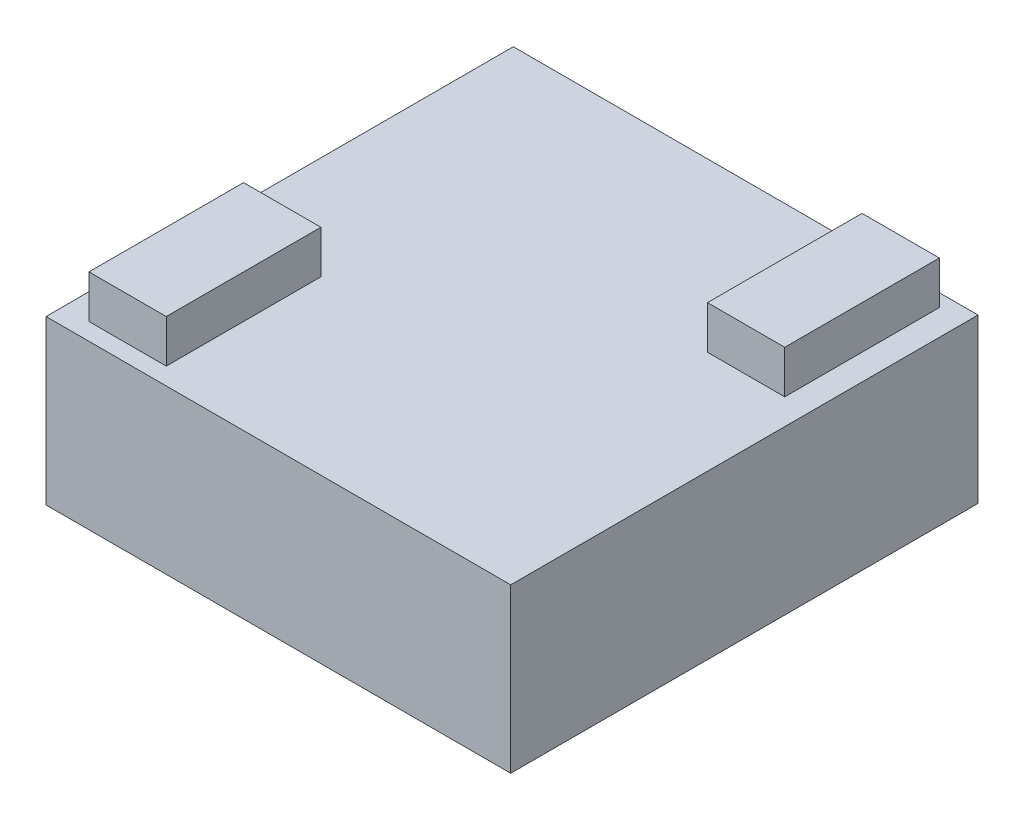
from build123d import *

# Parameters (mm, degrees)
ESQUISSE1_W        = 54.1
ESQUISSE1_H        = 54.4
BOSS_EXTRU_1_DEPTH = 19
ESQUISSE2_W        = 20
ESQUISSE2_H        = 12
BOSS_EXTRU_2_DEPTH = 15
ESQUISSE3_W        = 9
ESQUISSE3_H        = 18
BOSS_EXTRU_3_DEPTH = 5


with BuildPart() as part:
    # Esquisse1 → Boss.-Extru.1 (new body)
    with BuildSketch(Plane(origin=(0, 0, 0), x_dir=(1, 0, 0), z_dir=(0, 1, 0))):
        with Locations((27.05, 27.2)):
            Rectangle(ESQUISSE1_W, ESQUISSE1_H)
    extrude(amount=BOSS_EXTRU_1_DEPTH)

    # Esquisse2 → Boss.-Extru.2 (add)
    with BuildSketch(Plane.XZ):
        with Locations((27, -28.4)):
            Rectangle(ESQUISSE2_W, ESQUISSE2_H)
    extrude(amount=BOSS_EXTRU_2_DEPTH)

    # Esquisse3 → Boss.-Extru.3 (add)
    with BuildSketch(Plane(origin=(0, 19, 0), x_dir=(1, 0, 0), z_dir=(0, 1, 0))):
        with Locations((46.6, 43.9)):
            Rectangle(ESQUISSE3_W, ESQUISSE3_H)
        with Locations((7.5, 11)):
            Rectangle(ESQUISSE3_W, ESQUISSE3_H)
    extrude(amount=BOSS_EXTRU_3_DEPTH)


solid = part.part
